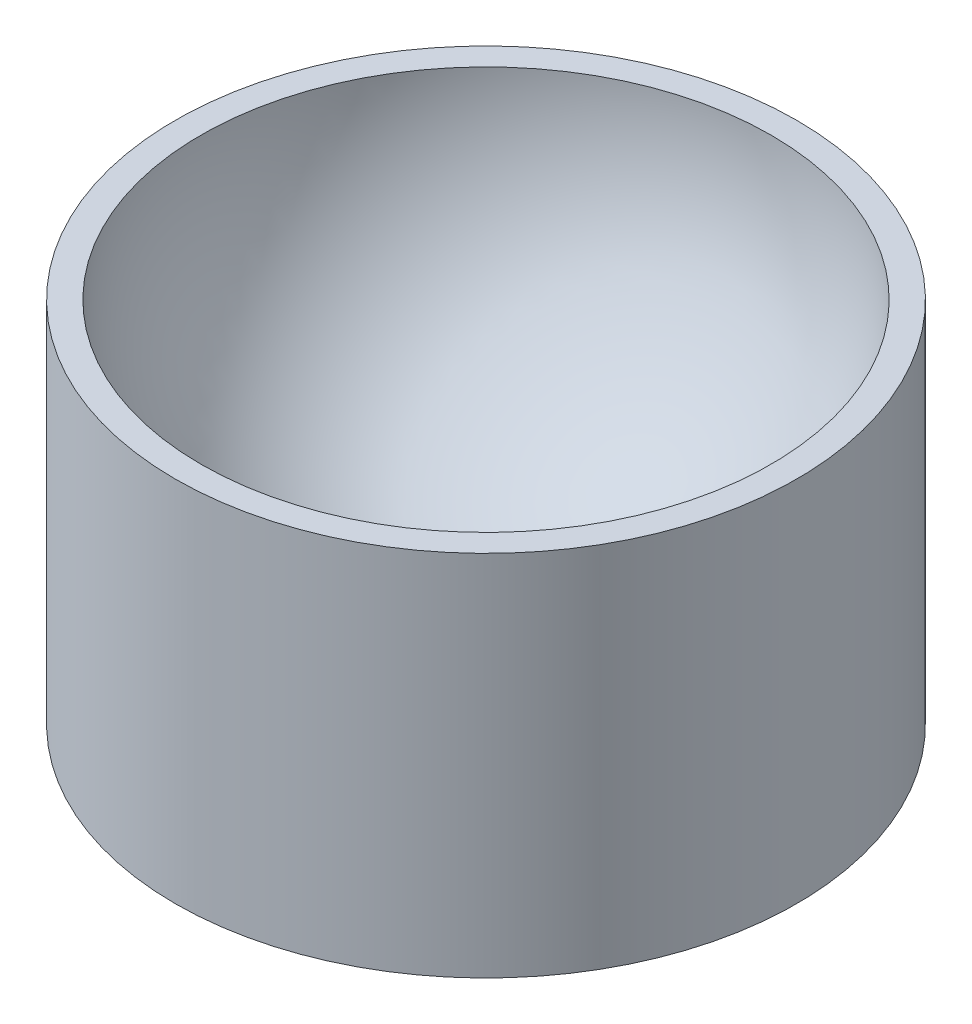
from build123d import *

# Parameters (mm, degrees)
SKETCH2_R           = 54.5
BOSS_EXTRUDE1_DEPTH = 11.5
SKETCH3_R           = 8
CUT_EXTRUDE1_DEPTH  = 7


with BuildPart() as part:
    # Sketch2 → Boss-Extrude1 (new body)
    with BuildSketch(Plane(origin=(0, 0, 0), x_dir=(1, 0, 0), z_dir=(0, 1, 0))):
        with Locations(Location((0, 0, 0), (0, 0, 270))):
            Circle(SKETCH2_R)
        Polygon((0, 7.505553499), (-6.5, 3.75277675), (-6.5, -3.75277675), (0, -7.505553499), (6.5, -3.75277675), (6.5, 3.75277675), align=None, mode=Mode.SUBTRACT)
    extrude(amount=BOSS_EXTRUDE1_DEPTH)

    # Sketch3 → Cut-Extrude1 (cut)
    with BuildSketch(Plane.XZ):
        with Locations(Location((0, 0, 0), (0, 0, 270))):
            Circle(SKETCH3_R)
    extrude(amount=-CUT_EXTRUDE1_DEPTH, mode=Mode.SUBTRACT)

    # Sketch4 → Revolve1 (revolve)
    with BuildSketch(Plane.XY, mode=Mode.PRIVATE) as revolve1_sk:
        with BuildLine():
            Line((4.05, 14.664294928), (4.05, 11.5))
            Line((4.05, 11.5), (54.5, 11.5))
            Line((54.5, 11.5), (54.5, 64.5))
            Line((54.5, 64.5), (50, 64.5))
            ThreePointArc((50, 64.5), (36.759352551, 30.60678534), (4.05, 14.664294928))
        make_face()
    revolve(revolve1_sk.sketch.rotate(Axis((0, 0, 0), (0, 1, 0)), 90), axis=Axis((0, 0, 0), (0, 1, 0)))


solid = part.part
